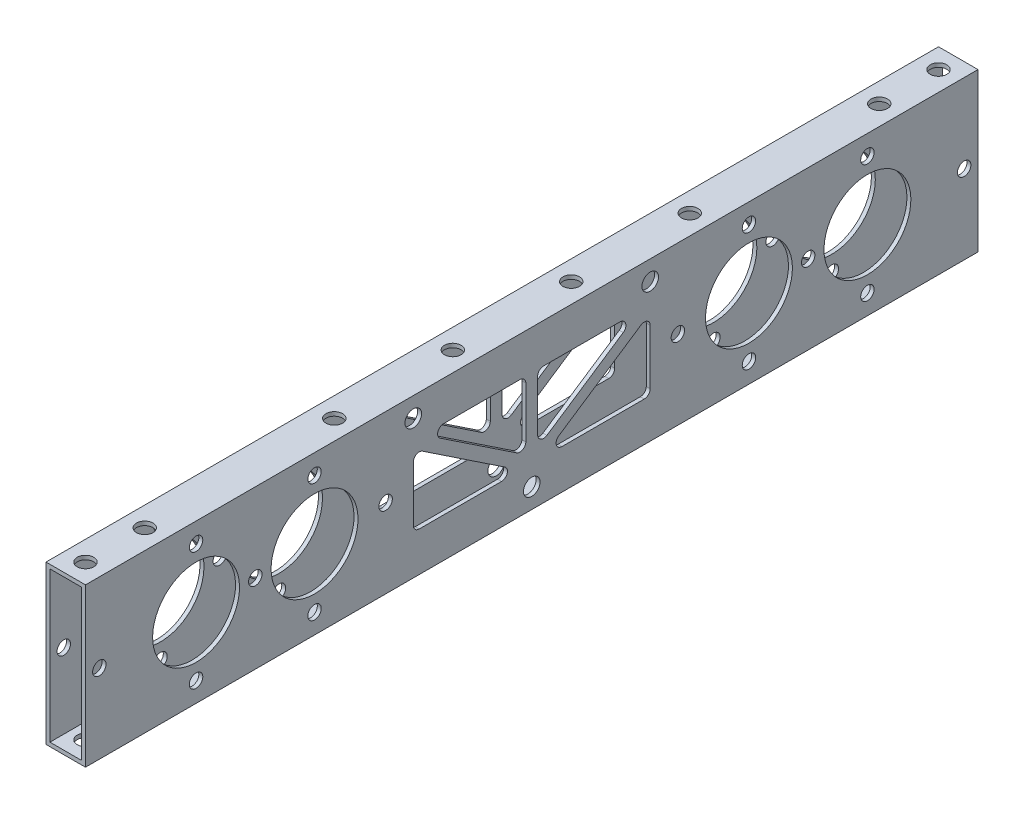
from build123d import *

# Parameters (mm, degrees)
SKETCH_1_W          = 10
SKETCH_1_H          = 40
SKETCH_1_W_2        = 8
SKETCH_1_H_2        = 38
EXTRUDE_1_DEPTH     = 113
SKETCH_3_R          = 2.1
CUT_EXTRUDE_1_DEPTH = 15
SKETCH_5_R          = 2.1
CUT_EXTRUDE_3_DEPTH = 25
CUT_EXTRUDE_4_DEPTH = 25
FILLET_3_R          = 1.5
FILLET_4_R          = 1.5
SKETCH_10_R         = 11
CUT_EXTRUDE_6_DEPTH = 25
CUT_EXTRUDE_7_REACH = 121.975
SKETCH_11_R         = 2.05
SKETCH_12_R         = 2.1
CUT_EXTRUDE_8_DEPTH = 120.974997395
SKETCH_15_R         = 2.1
SKETCH_15_R_2       = 1.7
CUT_EXTRUDE_9_DEPTH = 116.331045257


with BuildPart() as part:
    # 草图1 → 凸台-拉伸1 (new, symmetric)
    with BuildSketch(Plane.XY):
        Rectangle(SKETCH_1_W, SKETCH_1_H)
        Rectangle(SKETCH_1_W_2, SKETCH_1_H_2, mode=Mode.SUBTRACT)
    extrude(amount=EXTRUDE_1_DEPTH, both=True)

    # 草图3 → 切除-拉伸1 (cut, symmetric)
    with BuildSketch(Plane(origin=(0, 0, 0), x_dir=(0, 0, -1), z_dir=(1, 0, 0))):
        with Locations(Location((30, 15, 0), (0, 0, 270))):
            Circle(SKETCH_3_R)
        with Locations(Location((-30, 15, 0), (0, 0, 270))):
            Circle(SKETCH_3_R)
        with Locations(Location((0, -15, 0), (0, 0, 270))):
            Circle(SKETCH_3_R)
    extrude(amount=CUT_EXTRUDE_1_DEPTH, both=True, mode=Mode.SUBTRACT)

    # 草图5 → 切除-拉伸3 (cut, symmetric)
    with BuildSketch(Plane(origin=(0, 0, 0), x_dir=(1, 0, 0), z_dir=(0, 1, 0))):
        with Locations(Location((0, 15, 0), (0, 0, 90))):
            Circle(SKETCH_5_R)
        with Locations(Location((0, 45, 0), (0, 0, 90))):
            Circle(SKETCH_5_R)
        with Locations(Location((0, -45, 0), (0, 0, 90))):
            Circle(SKETCH_5_R)
        with Locations(Location((0, -15, 0), (0, 0, 90))):
            Circle(SKETCH_5_R)
    extrude(amount=CUT_EXTRUDE_3_DEPTH, both=True, mode=Mode.SUBTRACT)

    # 草图7 → 切除-拉伸4 (cut, symmetric)
    with BuildSketch(Plane(origin=(0, 0, 0), x_dir=(0, 0, -1), z_dir=(1, 0, 0))):
        Polygon((-1.5, -7.197224362), (-1.5, 10), (-27.295836543, 10), align=None)
        Polygon((27.295836543, 10), (1.5, 10), (1.5, -7.197224362), align=None)
        Polygon((30, 8.197224362), (2.704163457, -10), (30, -10), align=None)
        Polygon((-30, -10), (-2.704163457, -10), (-30, 8.197224362), align=None)
    extrude(amount=CUT_EXTRUDE_4_DEPTH, both=True, mode=Mode.SUBTRACT)

    # 圆角3
    fillet_3_edges = [part.edges().sort_by_distance(p)[0] for p in [
        (4.5, 8.197224362, 30),
        (4.5, -10, 2.704163457),
        (4.5, -10, 30),
        (4.5, 10, -27.295836543),
        (4.5, -7.197224362, -1.5),
        (4.5, 10, -1.5),
        (4.5, 8.197224362, -30),
        (4.5, -10, -30),
        (4.5, -10, -2.704163457),
        (4.5, 10, 1.5),
        (4.5, -7.197224362, 1.5),
        (4.5, 10, 27.295836543),
    ]]
    fillet(fillet_3_edges, radius=FILLET_3_R)

    # 圆角4
    fillet_4_edges = [part.edges().sort_by_distance(p)[0] for p in [
        (-4.5, 8.197224362, 30),
        (-4.5, -10, 2.704163457),
        (-4.5, -10, 30),
        (-4.5, 10, -27.295836543),
        (-4.5, -7.197224362, -1.5),
        (-4.5, 10, -1.5),
        (-4.5, 8.197224362, -30),
        (-4.5, -10, -30),
        (-4.5, -10, -2.704163457),
        (-4.5, 10, 1.5),
        (-4.5, -7.197224362, 1.5),
        (-4.5, 10, 27.295836543),
    ]]
    fillet(fillet_4_edges, radius=FILLET_4_R)

    # 草图10 → 切除-拉伸6 (cut, symmetric)
    with BuildSketch(Plane(origin=(0, 0, 0), x_dir=(0, 0, -1), z_dir=(1, 0, 0))):
        with Locations(Location((-85, 0, 0), (0, 0, 270))):
            Circle(SKETCH_10_R)
        with Locations(Location((-55, 0, 0), (0, 0, 270))):
            Circle(SKETCH_10_R)
        with Locations(Location((55, 0, 0), (0, 0, 270))):
            Circle(SKETCH_10_R)
        with Locations(Location((85, 0, 0), (0, 0, 270))):
            Circle(SKETCH_10_R)
    extrude(amount=CUT_EXTRUDE_6_DEPTH, both=True, mode=Mode.SUBTRACT)

    # 草图11 → 切除-拉伸7 (cut, up to next)
    with BuildSketch(Plane.XZ.offset(20), mode=Mode.PRIVATE) as cut_extrude_7_sk1:
        with Locations(Location((0, 0, 0), (0, 0, 270))):
            Circle(SKETCH_11_R)
    cut_extrude_7_tool1 = extrude(cut_extrude_7_sk1.sketch, amount=-CUT_EXTRUDE_7_REACH, mode=Mode.PRIVATE) & part.part
    add(cut_extrude_7_tool1.solids().sort_by_distance((0, -20, 0))[0], mode=Mode.SUBTRACT)

    # 草图12 → 切除-拉伸8 (cut, through all)
    with BuildSketch(Plane(origin=(0, 20, 0), x_dir=(1, 0, 0), z_dir=(0, 1, 0))):
        with Locations(Location((0, 108, 0), (0, 0, 270))):
            Circle(SKETCH_12_R)
        with Locations(Location((0, 93, 0), (0, 0, 270))):
            Circle(SKETCH_12_R)
        with Locations(Location((0, -108, 0), (0, 0, 270))):
            Circle(SKETCH_12_R)
        with Locations(Location((0, -93, 0), (0, 0, 270))):
            Circle(SKETCH_12_R)
    extrude(amount=-CUT_EXTRUDE_8_DEPTH, mode=Mode.SUBTRACT)

    # 草图15 → 切除-拉伸9 (cut, through all)
    with BuildSketch(Plane(origin=(6.5, 0, 0), x_dir=(0, 0, -1), z_dir=(1, 0, 0))):
        with Locations(Location((0, -15, 0), (0, 0, 270))):
            Circle(SKETCH_15_R)
        with Locations(Location((30, 15, 0), (0, 0, 270))):
            Circle(SKETCH_15_R)
        with Locations(Location((-30, 15, 0), (0, 0, 270))):
            Circle(SKETCH_15_R)
        with Locations(Location((-37, 0, 0), (0, 0, 270))):
            Circle(SKETCH_15_R_2)
        with Locations(Location((37, 0, 0), (0, 0, 270))):
            Circle(SKETCH_15_R_2)
        with Locations(Location((70, 0, 0), (0, 0, 270))):
            Circle(SKETCH_15_R_2)
        with Locations(Location((-109.5, 0, 0), (0, 0, 270))):
            Circle(SKETCH_15_R_2)
        with Locations(Location((-85, -15, 0), (0, 0, 270))):
            Circle(SKETCH_15_R_2)
        with Locations(Location((109.5, 0, 0), (0, 0, 270))):
            Circle(SKETCH_15_R_2)
        with Locations(Location((-55, 15, 0), (0, 0, 270))):
            Circle(SKETCH_15_R_2)
        with Locations(Location((-70, 0, 0), (0, 0, 270))):
            Circle(SKETCH_15_R_2)
        with Locations(Location((55, 15, 0), (0, 0, 270))):
            Circle(SKETCH_15_R_2)
        with Locations(Location((-55, -15, 0), (0, 0, 270))):
            Circle(SKETCH_15_R_2)
        with Locations(Location((85, 15, 0), (0, 0, 270))):
            Circle(SKETCH_15_R_2)
        with Locations(Location((-85, 15, 0), (0, 0, 270))):
            Circle(SKETCH_15_R_2)
        with Locations(Location((55, -15, 0), (0, 0, 270))):
            Circle(SKETCH_15_R_2)
        with Locations(Location((85, -15, 0), (0, 0, 270))):
            Circle(SKETCH_15_R_2)
    extrude(amount=-CUT_EXTRUDE_9_DEPTH, mode=Mode.SUBTRACT)


solid = part.part
